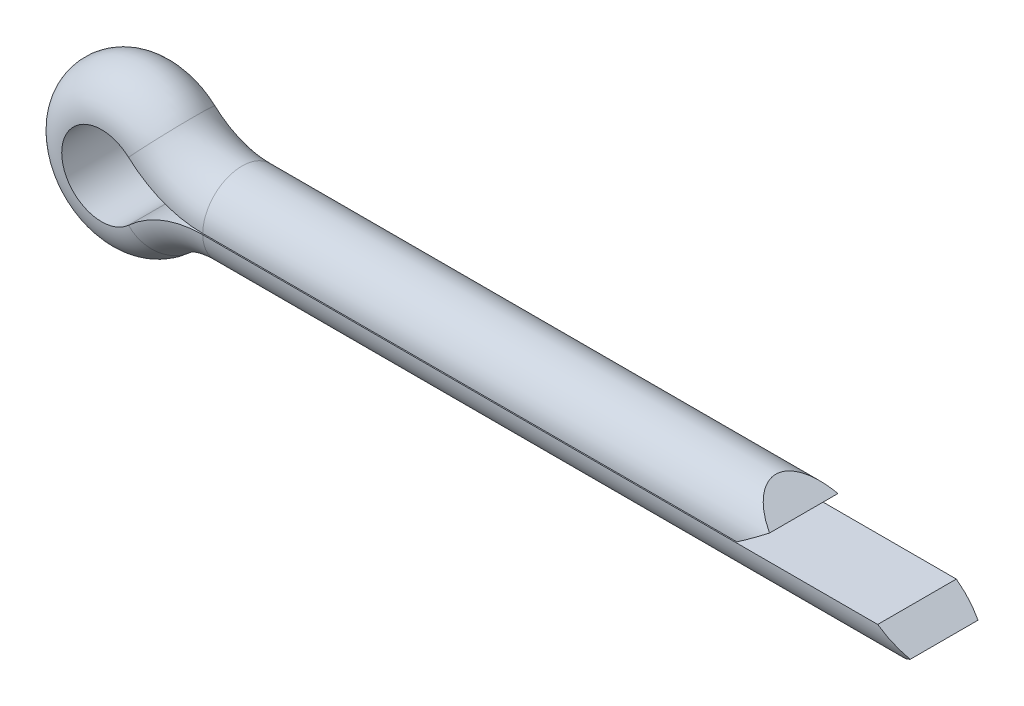
from build123d import *

# Parameters (mm, degrees)
CUT_EXTRUDE_1_DEPTH      = 15.385405814
CUT_EXTRUDE_1_DEPTH_BACK = 15.385405814


with BuildPart() as part:
    # 扫描2: sweep along a path in Sketch 200
    with BuildLine(Plane.XY) as sweep_2_path:
        Line((11.8, 0.7), (1.8, 0.7))
        ThreePointArc((1.8, 0.7), (1.34176437, 0.785965522), (0.945844504, 1.032171582))
        ThreePointArc((0.945844504, 1.032171582), (-1.4, 0), (0.945844504, -1.032171582))
        ThreePointArc((0.945844504, -1.032171582), (1.34176437, -0.785965522), (1.8, -0.7))
        Line((1.8, -0.7), (14.3, -0.7))
    # 草图2 → 扫描2 (sweep)
    with BuildSketch(Plane(origin=(11.8, 0.7, 0), x_dir=(0, 0, 1), z_dir=(-1, 0, 0))):
        with BuildLine():
            Line((-0.699928568, -0.69), (0.699928568, -0.69))
            ThreePointArc((0.699928568, -0.69), (0, 0), (-0.699928568, -0.69))
        make_face()
    sweep(path=sweep_2_path.line)

    # 草图3 → 切除-拉伸1 (cut, two sides: drawn at the far end of the back side and taken through both)
    with BuildSketch(Plane.XY.offset(-CUT_EXTRUDE_1_DEPTH_BACK)):
        Polygon((11.8, 0.345), (11.303649235, 0.7), (14.31, 0.7), (14.31, -0.7), (13.79664716, -0.7), (14.3, -0.355), (13.803649235, 0), (11.29664716, 0), align=None)
    extrude(amount=CUT_EXTRUDE_1_DEPTH + CUT_EXTRUDE_1_DEPTH_BACK, mode=Mode.SUBTRACT)


solid = part.part
